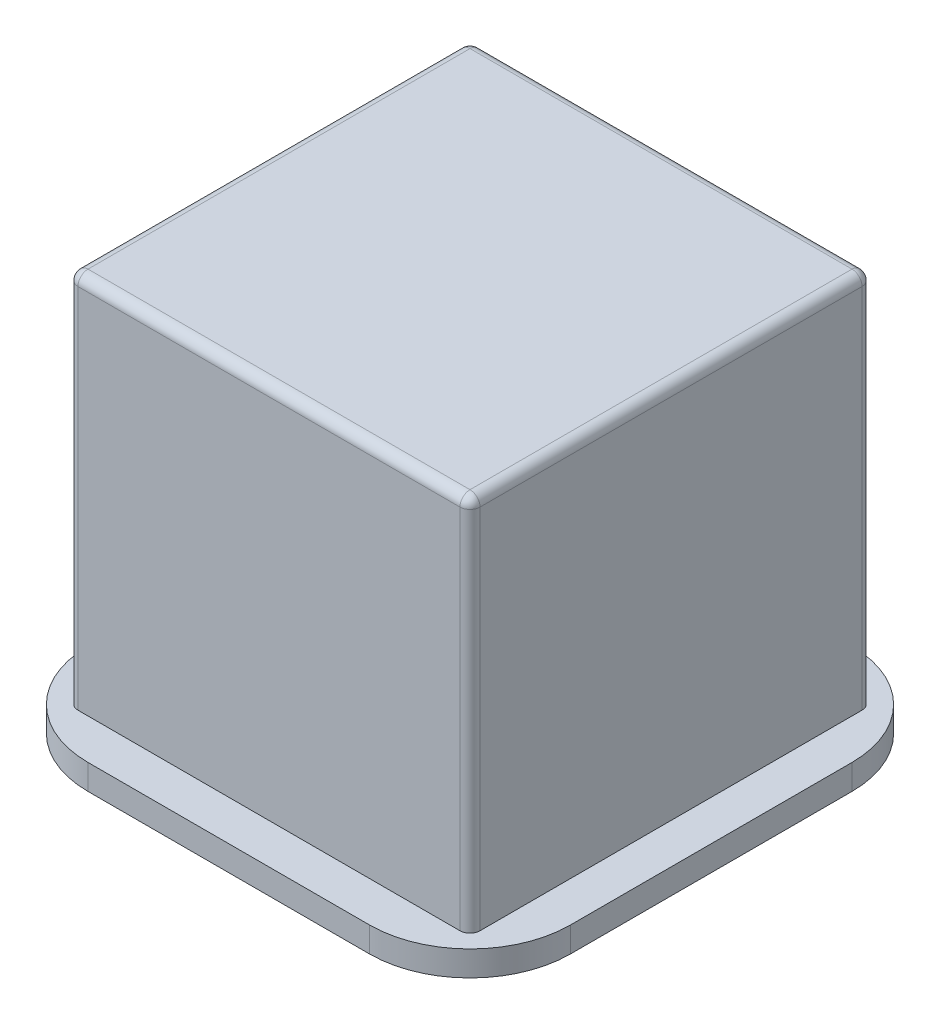
from build123d import *

# Parameters (mm, degrees)
SKETCH1_W           = 200
SKETCH1_H           = 200
BOSS_EXTRUDE1_DEPTH = 200
SKETCH3_W           = 200
SKETCH3_H           = 12.5
BOSS_EXTRUDE2_DEPTH = 20
SKETCH4_W           = 220
SKETCH4_H           = 12.5
BOSS_EXTRUDE3_DEPTH = 20
SKETCH5_W           = 220
SKETCH5_H           = 12.5
BOSS_EXTRUDE4_DEPTH = 20
SKETCH6_W           = 240
SKETCH6_H           = 12.5
BOSS_EXTRUDE5_DEPTH = 20
FILLET1_R           = 50
FILLET2_R           = 5
SHELL1_T            = -4


with BuildPart() as part:
    # Sketch1 → Boss-Extrude1 (new body)
    with BuildSketch(Plane(origin=(0, 0, 0), x_dir=(1, 0, 0), z_dir=(0, 1, 0))):
        with Locations((100, 100)):
            Rectangle(SKETCH1_W, SKETCH1_H)
    extrude(amount=BOSS_EXTRUDE1_DEPTH)

    # Sketch3 → Boss-Extrude2 (add)
    with BuildSketch(Plane.XY):
        with Locations((100, 6.25)):
            Rectangle(SKETCH3_W, SKETCH3_H)
    extrude(amount=BOSS_EXTRUDE2_DEPTH)

    # Sketch4 → Boss-Extrude3 (add)
    with BuildSketch(Plane(origin=(200, 0, 0), x_dir=(0, 0, -1), z_dir=(1, 0, 0))):
        with Locations((90, 6.25)):
            Rectangle(SKETCH4_W, SKETCH4_H)
    extrude(amount=BOSS_EXTRUDE3_DEPTH)

    # Sketch5 → Boss-Extrude4 (add)
    with BuildSketch(Plane(origin=(0, 0, -200), x_dir=(-1, 0, 0), z_dir=(0, 0, -1))):
        with Locations((-110, 6.25)):
            Rectangle(SKETCH5_W, SKETCH5_H)
    extrude(amount=BOSS_EXTRUDE4_DEPTH)

    # Sketch6 → Boss-Extrude5 (add)
    with BuildSketch(Plane.ZY):
        with Locations((-100, 6.25)):
            Rectangle(SKETCH6_W, SKETCH6_H)
    extrude(amount=BOSS_EXTRUDE5_DEPTH)

    # Fillet1
    fillet1_edges = [part.edges().sort_by_distance(p)[0] for p in [
        (220, 6.25, 20),
        (220, 6.25, -220),
        (-20, 6.25, -220),
        (-20, 6.25, 20),
    ]]
    fillet(fillet1_edges, radius=FILLET1_R)

    # Fillet2
    fillet2_edges = [part.edges().sort_by_distance(p)[0] for p in [
        (200, 200, -100),
        (100, 200, -200),
        (0, 200, -100),
        (100, 200, 0),
        (0, 106.25, -200),
        (200, 106.25, -200),
        (200, 106.25, 0),
        (0, 106.25, 0),
    ]]
    fillet(fillet2_edges, radius=FILLET2_R)

    # Shell1
    shell1_openings = [part.faces().sort_by_distance(p)[0] for p in [
        (100, 0, -100),
    ]]
    offset(amount=SHELL1_T, openings=shell1_openings, kind=Kind.INTERSECTION)


solid = part.part
